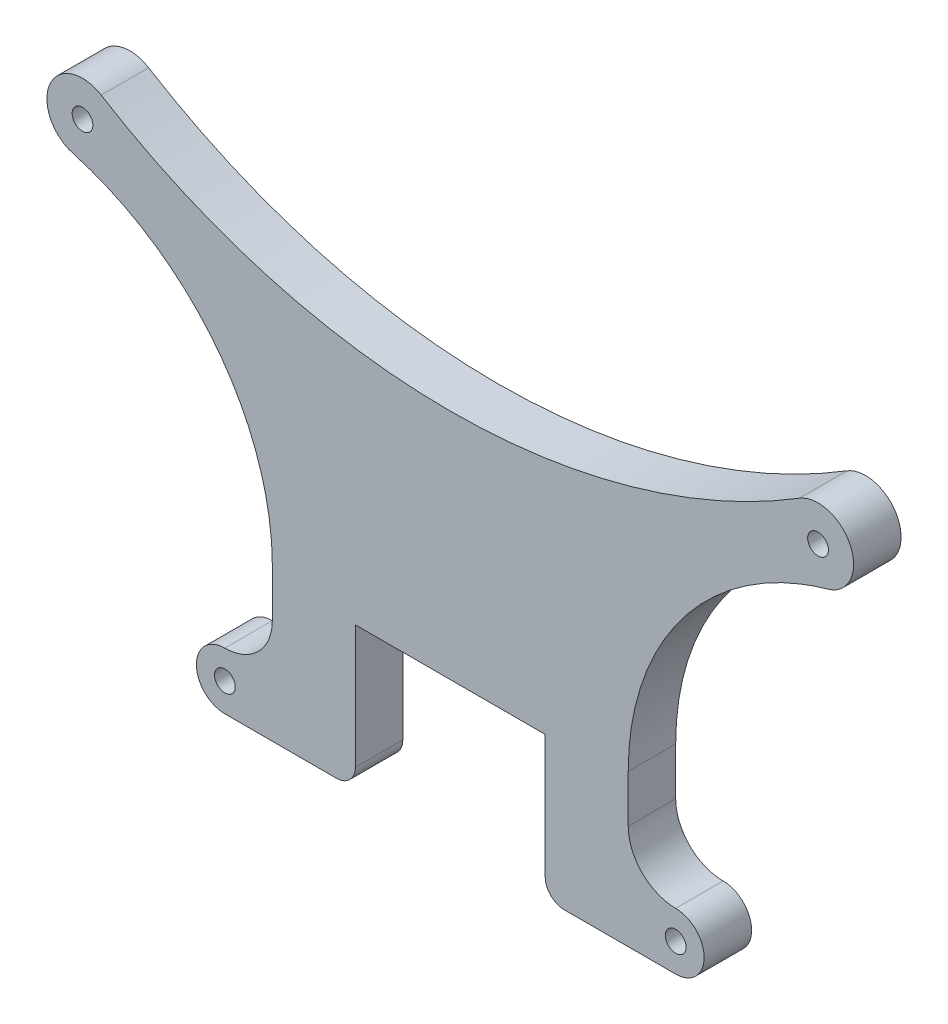
from build123d import *

# Parameters (mm, degrees)
SKETCH1_R           = 1.3890625
BOSS_EXTRUDE1_DEPTH = 6.35


with BuildPart() as part:
    # Sketch1 → Boss-Extrude1 (new body)
    with BuildSketch(Plane.XY):
        with BuildLine():
            Line((12.7, 0), (-12.7, 0))
            Line((-12.7, 0), (-12.7, -16.51))
            ThreePointArc((-12.7, -16.51), (-13.443948776, -18.306051224), (-15.24, -19.05))
            Line((-15.24, -19.05), (-30.1625, -19.05))
            ThreePointArc((-30.1625, -19.05), (-33.9725, -15.24), (-30.1625, -11.43))
            ThreePointArc((-30.1625, -11.43), (-25.672371939, -9.570128061), (-23.8125, -5.08))
            Line((-23.8125, -5.08), (-23.8125, 1.27))
            add(Edge.make_bspline(
                [(-23.8125, 1.27), (-23.8125, 28.224807165), (-50.502986928, 35.738173469)],
                knots=[0, 0, 0, 1.28831511, 1.28831511, 1.28831511], degree=2, weights=[1, 0.79960596, 1]))
            ThreePointArc((-50.502986928, 35.738173469), (-53.573053894, 42.237434983), (-46.71026588, 44.374688379))
            ThreePointArc((-46.71026588, 44.374688379), (0, 31.115), (46.71026588, 44.374688379))
            ThreePointArc((46.71026588, 44.374688379), (53.573053894, 42.237434983), (50.502986928, 35.738173469))
            add(Edge.make_bspline(
                [(50.502986928, 35.738173469), (23.8125, 28.224807165), (23.8125, 1.27)],
                knots=[1.853277544, 1.853277544, 1.853277544, 3.141592654, 3.141592654, 3.141592654], degree=2, weights=[1, 0.79960596, 1]))
            Line((23.8125, 1.27), (23.8125, -5.08))
            ThreePointArc((23.8125, -5.08), (25.672371939, -9.570128061), (30.1625, -11.43))
            ThreePointArc((30.1625, -11.43), (33.9725, -15.24), (30.1625, -19.05))
            Line((30.1625, -19.05), (15.24, -19.05))
            ThreePointArc((15.24, -19.05), (13.443948776, -18.306051224), (12.7, -16.51))
            Line((12.7, -16.51), (12.7, 0))
        make_face()
        with Locations((-49.2125, 40.3225)):
            Circle(SKETCH1_R, mode=Mode.SUBTRACT)
        with Locations((-30.1625, -15.24)):
            Circle(SKETCH1_R, mode=Mode.SUBTRACT)
        with Locations(Location((30.1625, -15.24, 0), (0, 0, 180))):
            Circle(SKETCH1_R, mode=Mode.SUBTRACT)
        with Locations(Location((49.2125, 40.3225, 0), (0, 0, 180))):
            Circle(SKETCH1_R, mode=Mode.SUBTRACT)
    extrude(amount=BOSS_EXTRUDE1_DEPTH)


solid = part.part
